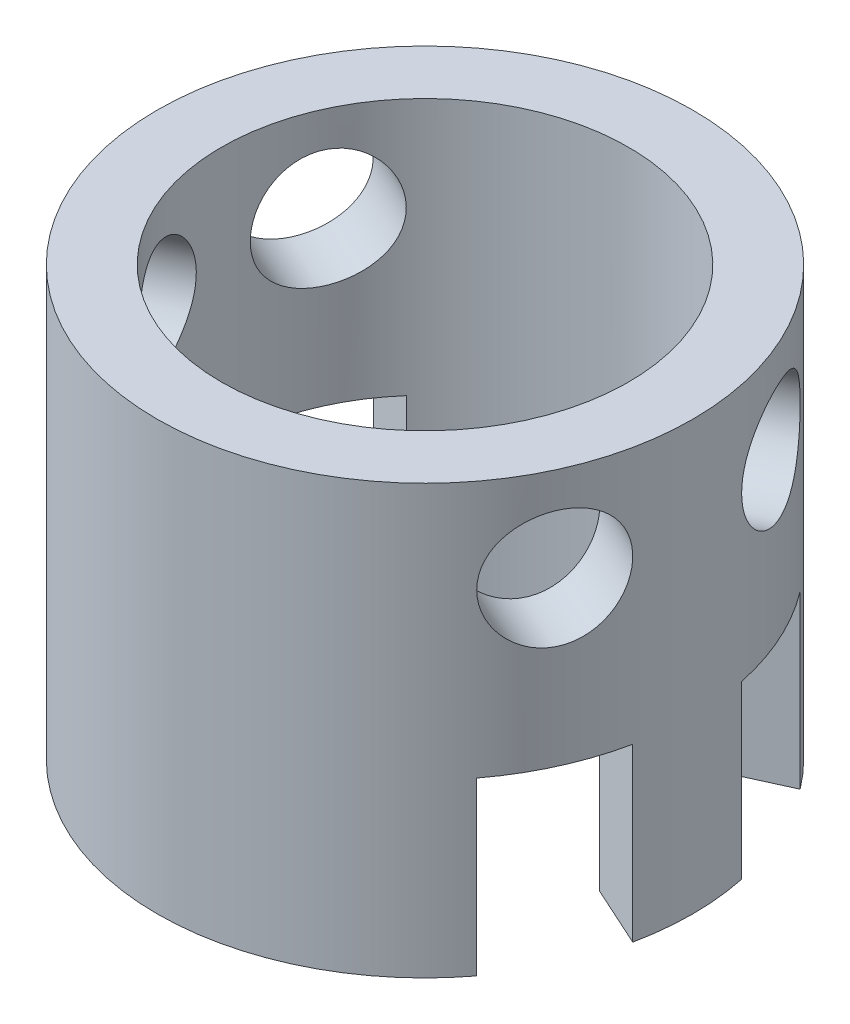
from build123d import *

# Parameters (mm, degrees)
SKETCH1_R               = 12.5
SKETCH1_R_2             = 9.5
BOSS_EXTRUDE1_DEPTH     = 20
CUT_EXTRUDE1_DEPTH      = 25.498499593
CUT_EXTRUDE1_DEPTH_BACK = 25.498499593
SKETCH2_R               = 2.75
CUT_EXTRUDE2_DEPTH      = 41.591596454
CUT_EXTRUDE2_DEPTH_BACK = 41.591596454
SKETCH3_R               = 2.75
CUT_EXTRUDE3_DEPTH      = 8


with BuildPart() as part:
    # Sketch1 → Boss-Extrude1 (new body)
    with BuildSketch(Plane(origin=(0, 0, 0), x_dir=(1, 0, 0), z_dir=(0, 1, 0))):
        with Locations(Location((0, 0, 0), (0, 0, 270))):
            Circle(SKETCH1_R)
        with Locations(Location((0, 0, 0), (0, 0, 270))):
            Circle(SKETCH1_R_2, mode=Mode.SUBTRACT)
    extrude(amount=BOSS_EXTRUDE1_DEPTH)

    # Sketch2 → Cut-Extrude1 (cut, two sides: drawn at the far end of the back side and taken through both)
    with BuildSketch(Plane(origin=(0, 3.038971661, 0), x_dir=(0.41379310344827586, 0, 0.9103709505133852), z_dir=(-0.9103709505133852, 0, 0.41379310344827586)).offset(-CUT_EXTRUDE1_DEPTH_BACK)):
        with Locations((0, 12.561028339)):
            Circle(SKETCH2_R)
    extrude(amount=CUT_EXTRUDE1_DEPTH + CUT_EXTRUDE1_DEPTH_BACK, mode=Mode.SUBTRACT)

    # Sketch3 → Cut-Extrude2 (cut, two sides: drawn at the far end of the back side and taken through both)
    with BuildSketch(Plane(origin=(-18.02534482, 3.038971661, -8.193103448), x_dir=(-0.41379310344827586, 0, 0.9103709505133852), z_dir=(-0.9103709505133852, 0, -0.41379310344827586)).offset(-CUT_EXTRUDE2_DEPTH_BACK)):
        with Locations((0, 12.561028339)):
            Circle(SKETCH3_R)
    extrude(amount=CUT_EXTRUDE2_DEPTH + CUT_EXTRUDE2_DEPTH_BACK, mode=Mode.SUBTRACT)

    # Sketch6 → Cut-Extrude3 (cut)
    with BuildSketch(Plane(origin=(0, 0, 0), x_dir=(1, 0, 0), z_dir=(0, 1, 0))):
        with BuildLine():
            Line((-9.962903285, -7.549209106), (-7.140314851, -6.266251179))
            ThreePointArc((-7.140314851, -6.266251179), (-8.64852403, -3.931034483), (-9.41617692, -1.259210951))
            Line((-9.41617692, -1.259210951), (-12.238765354, -2.542168878))
            ThreePointArc((-12.238765354, -2.542168878), (-11.379636881, -5.172413793), (-9.962903285, -7.549209106))
        make_face()
        with BuildLine():
            Line((-12.238765354, 2.542168878), (-9.41617692, 1.259210951))
            ThreePointArc((-9.41617692, 1.259210951), (-8.64852403, 3.931034483), (-7.140314851, 6.266251179))
            Line((-7.140314851, 6.266251179), (-9.962903285, 7.549209106))
            ThreePointArc((-9.962903285, 7.549209106), (-11.379636881, 5.172413793), (-12.238765354, 2.542168878))
        make_face()
        with BuildLine():
            Line((7.140314851, 6.266251179), (9.962903285, 7.549209106))
            ThreePointArc((9.962903285, 7.549209106), (11.379636881, 5.172413793), (12.238765354, 2.542168878))
            Line((12.238765354, 2.542168878), (9.41617692, 1.259210951))
            ThreePointArc((9.41617692, 1.259210951), (8.64852403, 3.931034483), (7.140314851, 6.266251179))
        make_face()
        with BuildLine():
            Line((7.140314851, -6.266251179), (9.962903285, -7.549209106))
            ThreePointArc((9.962903285, -7.549209106), (11.379636881, -5.172413793), (12.238765354, -2.542168878))
            Line((12.238765354, -2.542168878), (9.41617692, -1.259210951))
            ThreePointArc((9.41617692, -1.259210951), (8.64852403, -3.931034483), (7.140314851, -6.266251179))
        make_face()
    extrude(amount=CUT_EXTRUDE3_DEPTH, mode=Mode.SUBTRACT)


solid = part.part
